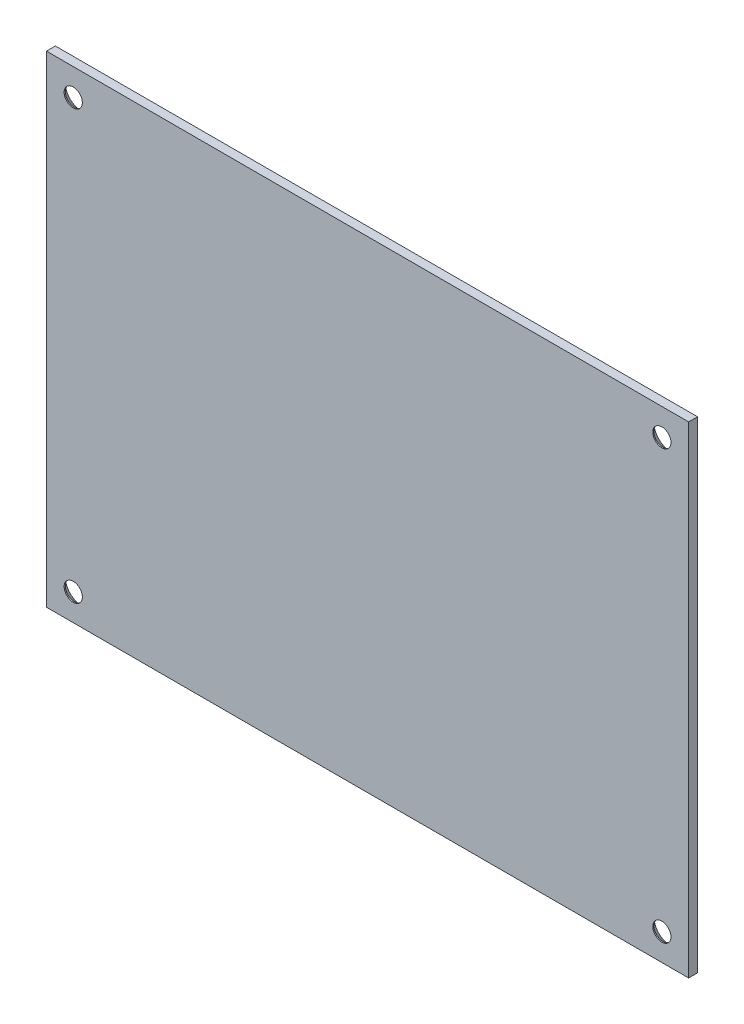
from build123d import *

# Parameters (mm, degrees)
SKETCH1_W                                           = 120
SKETCH1_H                                           = 90
BOSS_EXTRUDE1_DEPTH                                 = 1.66
CSK_FOR_M3_COUNTERSUNK_FLAT_HEAD_SCREW1_D           = 3.4
CSK_FOR_M3_COUNTERSUNK_FLAT_HEAD_SCREW1_DEPTH       = 30
CSK_FOR_M3_COUNTERSUNK_FLAT_HEAD_SCREW1_CSINK_D     = 6.3
CSK_FOR_M3_COUNTERSUNK_FLAT_HEAD_SCREW1_CSINK_ANGLE = 90
CSK_FOR_M3_COUNTERSUNK_FLAT_HEAD_SCREW1_TIP         = 1.021463052


with BuildPart() as part:
    # Sketch1 → Boss-Extrude1 (new body)
    with BuildSketch(Plane.XY):
        with Locations((60, 45)):
            Rectangle(SKETCH1_W, SKETCH1_H)
    extrude(amount=BOSS_EXTRUDE1_DEPTH)

    # CSK for M3 Countersunk Flat Head Screw1
    with Locations(Plane(origin=(0, 0, 0), x_dir=(-1, 0, 0), z_dir=(0, 0, -1))):
        with Locations((-5, 5), (-5, 85), (-115, 85), (-115, 5)):
            CounterSinkHole(CSK_FOR_M3_COUNTERSUNK_FLAT_HEAD_SCREW1_D / 2, CSK_FOR_M3_COUNTERSUNK_FLAT_HEAD_SCREW1_CSINK_D / 2, depth=CSK_FOR_M3_COUNTERSUNK_FLAT_HEAD_SCREW1_DEPTH, counter_sink_angle=CSK_FOR_M3_COUNTERSUNK_FLAT_HEAD_SCREW1_CSINK_ANGLE)
            with Locations((0, 0, -(CSK_FOR_M3_COUNTERSUNK_FLAT_HEAD_SCREW1_DEPTH + CSK_FOR_M3_COUNTERSUNK_FLAT_HEAD_SCREW1_TIP / 2))):  # 118° drill point
                Cone(0, CSK_FOR_M3_COUNTERSUNK_FLAT_HEAD_SCREW1_D / 2, CSK_FOR_M3_COUNTERSUNK_FLAT_HEAD_SCREW1_TIP, mode=Mode.SUBTRACT)


solid = part.part
